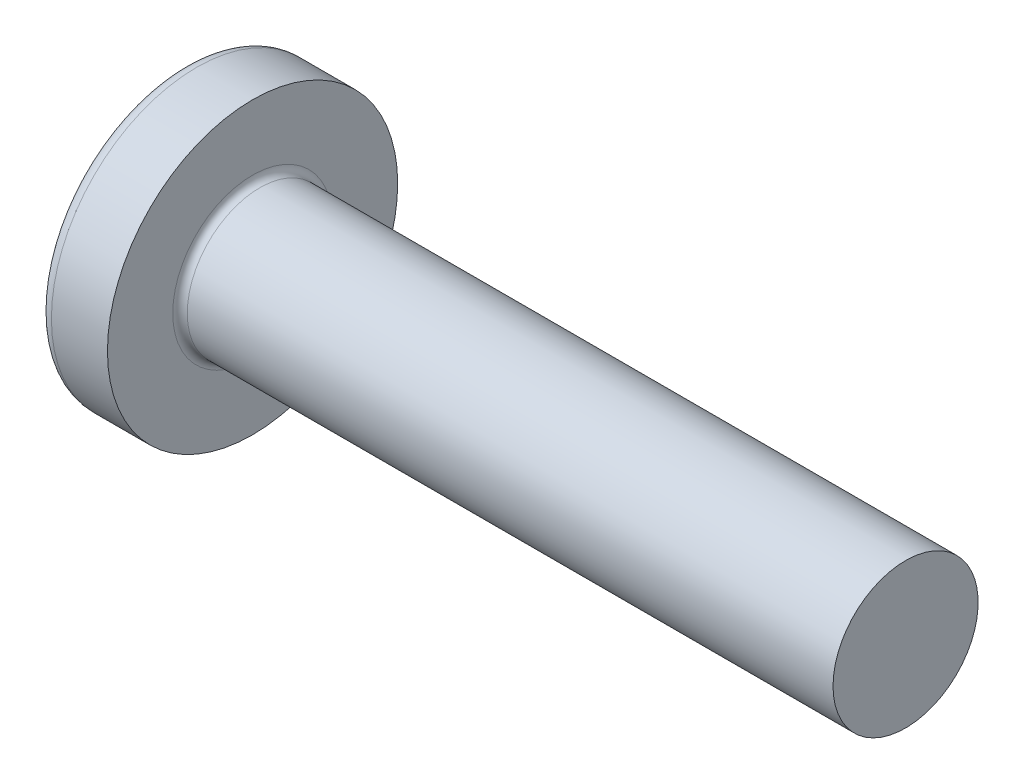
from build123d import *

# Parameters (mm, degrees)
FILLET1_R    = 0.2
RECPAT_COUNT = 2
RECPAT_ANGLE = 90


with BuildPart() as part:
    # BodySke → Base-Revolve (revolve)
    with BuildSketch(Plane.XY, mode=Mode.PRIVATE) as base_revolve_sk:
        with BuildLine():
            Line((3.1, 2), (3.1, 4))
            Line((3.1, 4), (1.555305874, 4))
            ThreePointArc((1.555305874, 4), (1.392873227, 3.961271902), (1.265388955, 3.853420195))
            ThreePointArc((1.265388955, 3.853420195), (0.324444487, 2.027933456), (0, 0))
            Line((0, 0), (21.1, 0))
            Line((21.1, 0), (21.1, 2))
            Line((21.1, 2), (3.1, 2))
        make_face()
    revolve(base_revolve_sk.sketch.rotate(Axis((1.555305874, 0, 0), (1, 0, 0)), 90), axis=Axis((1.555305874, 0, 0), (1, 0, 0)))

    # Fillet1
    fillet1_edges = [part.edges().sort_by_distance(p)[0] for p in [
        (3.1, 0, -2),
    ]]
    fillet(fillet1_edges, radius=FILLET1_R)

    # Sketch3 → Recess section 0
    with BuildSketch(Plane(origin=(0, 0, 0), x_dir=(0, 0, -1), z_dir=(1, 0, 0))):
        with BuildLine():
            Line((0.515, -2.15), (-0.515, -2.15))
            Line((-0.515, -2.15), (-0.515, 2.15))
            Line((-0.515, 2.15), (0.515, 2.15))
            Line((0.515, 2.15), (0.515, -2.15))
        make_face()
    # Sketch4 → Recess section 1
    with BuildSketch(Plane(origin=(2.34, 0, 0), x_dir=(0, 0, -1), z_dir=(1, 0, 0))):
        with BuildLine():
            Line((0.515, -0.983319232), (-0.515, -0.983319232))
            Line((-0.515, -0.983319232), (-0.515, 0.983319232))
            Line((-0.515, 0.983319232), (0.515, 0.983319232))
            Line((0.515, 0.983319232), (0.515, -0.983319232))
        make_face()
    recess = loft(mode=Mode.SUBTRACT)

    # RecPat: Recess ×2 about axis
    recpat_axis = Axis((0, 0, 0), (1, 0, 0))
    for i in range(1, RECPAT_COUNT):
        add(recess.rotate(recpat_axis, i * RECPAT_ANGLE / (RECPAT_COUNT - 1)), mode=Mode.SUBTRACT)

    # RecCorSke → RecessCore (revolve, cut)
    with BuildSketch(Plane.XY, mode=Mode.PRIVATE) as recesscore_sk:
        Polygon((0, 0), (0, 1.01462874), (2.34, 0.851), (2.616506661, 0), align=None)
    revolve(recesscore_sk.sketch.rotate(Axis((-3.175, 0, 0), (1, 0, 0)), 14.547591759), axis=Axis((-3.175, 0, 0), (1, 0, 0)), mode=Mode.SUBTRACT)


solid = part.part
